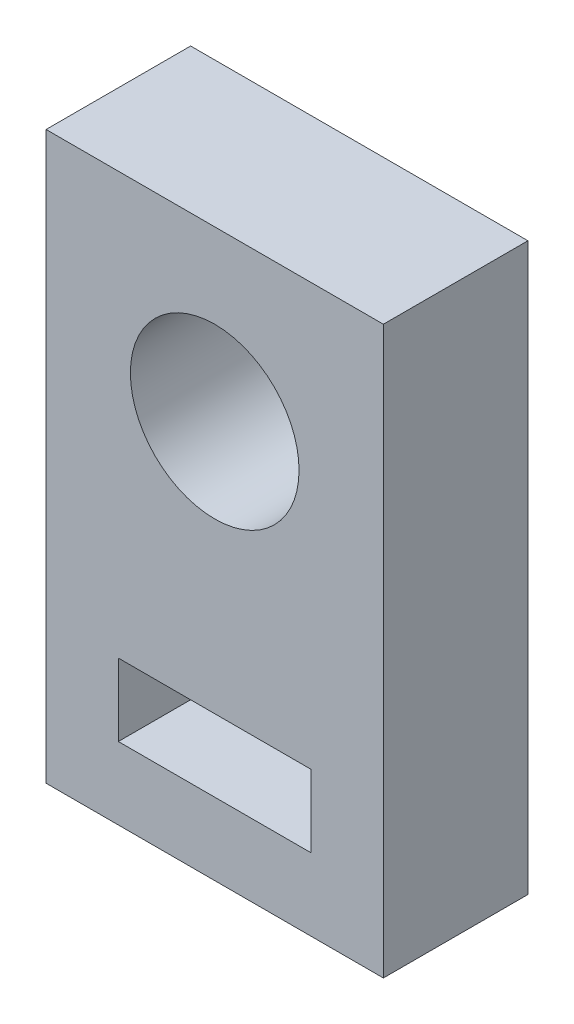
from build123d import *

# Parameters (mm, degrees)
SKETCH1_W           = 14
SKETCH1_H           = 23.5
SKETCH1_R           = 3.5
SKETCH1_W_2         = 8
SKETCH1_H_2         = 3
BOSS_EXTRUDE2_DEPTH = 6


with BuildPart() as part:
    # Sketch1 → Boss-Extrude2 (new body)
    with BuildSketch(Plane.XY):
        with Locations((0.151915527, 3.785637599)):
            Rectangle(SKETCH1_W, SKETCH1_H)
        with Locations((0.151915527, 8.535637599)):
            Circle(SKETCH1_R, mode=Mode.SUBTRACT)
        with Locations((0.151915527, -3.464362401)):
            Rectangle(SKETCH1_W_2, SKETCH1_H_2, mode=Mode.SUBTRACT)
    extrude(amount=BOSS_EXTRUDE2_DEPTH)


solid = part.part
